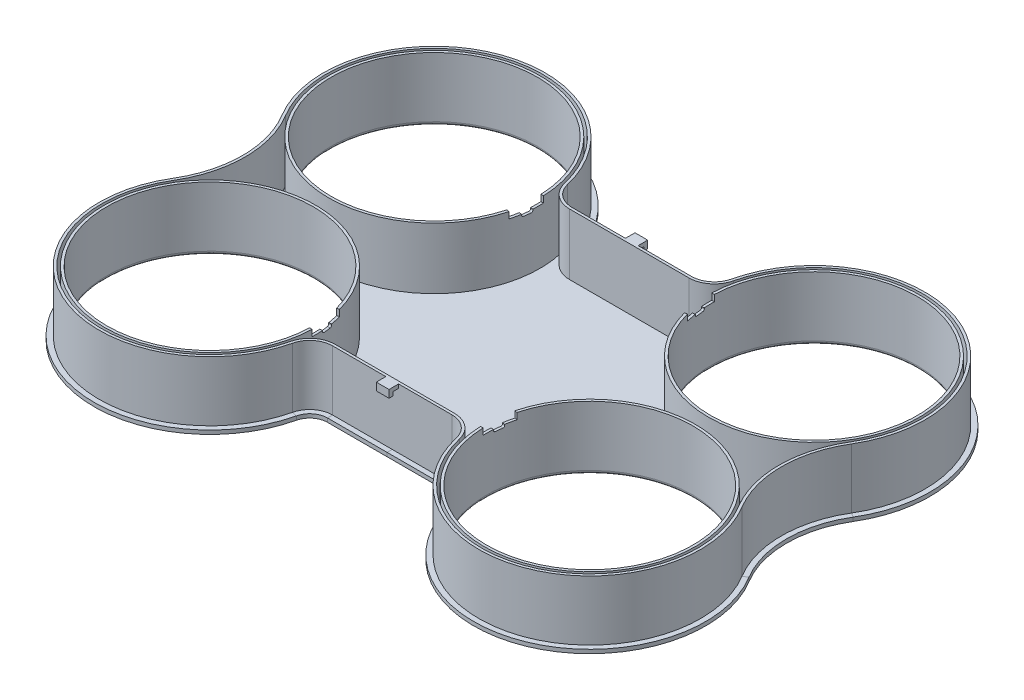
from build123d import *

# Parameters (mm, degrees)
BASE_DEPTH                                  = 25
SKETCH3_R                                   = 40.5
PROPHOLES_DEPTH                             = 25
SHELL2_T                                    = -1
SKETCH4_W                                   = 2
SKETCH4_H                                   = 1.5
HOOKS_DEPTH                                 = 2.5
FILLET1_R                                   = 1.5
ARMHOLES_DEPTH                              = 2.5
ARMDETAILCUT_DEPTH                          = 2.5
ARMDETAILS_AT_THE_SECOND_PLANE_COPY_1_DEPTH = 2.5


with BuildPart() as part:
    # Sketch1 → Base (new body)
    with BuildSketch(Plane(origin=(0, 0, 0), x_dir=(1, 0, 0), z_dir=(0, 1, 0))):
        with BuildLine():
            Line((-23.389824888, 47), (23.389824888, 47))
            ThreePointArc((23.389824888, 47), (28.979355918, 48.946125685), (32.151569193, 53.942857143))
            ThreePointArc((32.151569193, 53.942857143), (90.931692418, 84.277158344), (111.718349922, 21.482352941))
            ThreePointArc((111.718349922, 21.482352941), (105.725511342, 0), (111.718349922, -21.482352941))
            ThreePointArc((111.718349922, -21.482352941), (90.931692418, -84.277158344), (32.151569193, -53.942857143))
            ThreePointArc((32.151569193, -53.942857143), (28.979355918, -48.946125685), (23.389824888, -47))
            Line((23.389824888, -47), (-23.389824888, -47))
            ThreePointArc((-23.389824888, -47), (-28.979355918, -48.946125685), (-32.151569193, -53.942857143))
            ThreePointArc((-32.151569193, -53.942857143), (-90.931692418, -84.277158344), (-111.718349922, -21.482352941))
            ThreePointArc((-111.718349922, -21.482352941), (-105.725511342, 0), (-111.718349922, 21.482352941))
            ThreePointArc((-111.718349922, 21.482352941), (-90.931692418, 84.277158344), (-32.151569193, 53.942857143))
            ThreePointArc((-32.151569193, 53.942857143), (-28.979355918, 48.946125685), (-23.389824888, 47))
        make_face()
    extrude(amount=BASE_DEPTH)

    # Sketch3 → PropHoles (cut)
    with BuildSketch(Plane(origin=(0, 25, 0), x_dir=(1, 0, 0), z_dir=(0, 1, 0))):
        with Locations((74.5, 44)):
            Circle(SKETCH3_R)
        with Locations((74.5, -44)):
            Circle(SKETCH3_R)
        with Locations((-74.5, -44)):
            Circle(SKETCH3_R)
        with Locations((-74.5, 44)):
            Circle(SKETCH3_R)
    extrude(amount=-PROPHOLES_DEPTH, mode=Mode.SUBTRACT)

    # Shell2
    shell2_openings = [part.faces().sort_by_distance(p)[0] for p in [
        (0, 25, 0),
    ]]
    offset(amount=SHELL2_T, openings=shell2_openings, kind=Kind.INTERSECTION)

    # Lip: sweep along a path in Sketch1<2>
    with BuildLine(Plane(origin=(0, 0, 0), x_dir=(1, 0, 0), z_dir=(0, 1, 0))) as lip_path:
        Line((-23.389824888, 47), (23.389824888, 47))
        ThreePointArc((23.389824888, 47), (28.979355918, 48.946125685), (32.151569193, 53.942857143))
        ThreePointArc((32.151569193, 53.942857143), (90.931692418, 84.277158344), (111.718349922, 21.482352941))
        ThreePointArc((111.718349922, 21.482352941), (105.725511342, 0), (111.718349922, -21.482352941))
        ThreePointArc((111.718349922, -21.482352941), (90.931692418, -84.277158344), (32.151569193, -53.942857143))
        ThreePointArc((32.151569193, -53.942857143), (28.979355918, -48.946125685), (23.389824888, -47))
        Line((23.389824888, -47), (-23.389824888, -47))
        ThreePointArc((-23.389824888, -47), (-28.979355918, -48.946125685), (-32.151569193, -53.942857143))
        ThreePointArc((-32.151569193, -53.942857143), (-90.931692418, -84.277158344), (-111.718349922, -21.482352941))
        ThreePointArc((-111.718349922, -21.482352941), (-105.725511342, 0), (-111.718349922, 21.482352941))
        ThreePointArc((-111.718349922, 21.482352941), (-90.931692418, 84.277158344), (-32.151569193, 53.942857143))
        ThreePointArc((-32.151569193, 53.942857143), (-28.979355918, 48.946125685), (-23.389824888, 47))
    # Sketch4 → Lip (sweep)
    with BuildSketch(Plane(origin=(0, 0, 0), x_dir=(0, 0, -1), z_dir=(1, 0, 0))):
        with Locations((-48, 0.75)):
            Rectangle(SKETCH4_W, SKETCH4_H)
    sweep(path=lip_path.line)

    # Sketch5 → Hooks (add, symmetric)
    with BuildSketch(Plane(origin=(0, 0, 0), x_dir=(0, 0, -1), z_dir=(1, 0, 0))):
        Polygon((-47, 25), (-50.75, 25), (-50.75, 22), (-49.25, 22), (-49.25, 23.5), (-47, 23.5), align=None)
        Polygon((49.25, 23.5), (47, 23.5), (47, 25), (50.75, 25), (50.75, 22), (49.25, 22), align=None)
    extrude(amount=HOOKS_DEPTH, both=True)

    # Fillet1
    fillet1_edges = [part.edges().sort_by_distance(p)[0] for p in [
        (-115, 0, -44),
        (34, 0, -44),
        (34, 0, 44),
        (-115, 0, 44),
    ]]
    fillet(fillet1_edges, radius=FILLET1_R)

    # Sketch6 → ArmHoles (cut)
    with BuildSketch(Plane(origin=(0, 25, 0), x_dir=(1, 0, 0), z_dir=(0, 1, 0))):
        with BuildLine():
            Line((74.5, -44), (34.426621288, -33.212307077))
            ThreePointArc((34.426621288, -33.212307077), (33.272270217, -39.25402308), (33.02362118, -45.4))
            Line((33.02362118, -45.4), (74.5, -44))
        make_face()
        with BuildLine():
            Line((74.5, 44), (33.02362118, 45.4))
            ThreePointArc((33.02362118, 45.4), (33.272270217, 39.25402308), (34.426621288, 33.212307077))
            Line((34.426621288, 33.212307077), (74.5, 44))
        make_face()
        with BuildLine():
            Line((-74.5, 44), (-34.426621288, 33.212307077))
            ThreePointArc((-34.426621288, 33.212307077), (-33.272270217, 39.25402308), (-33.02362118, 45.4))
            Line((-33.02362118, 45.4), (-74.5, 44))
        make_face()
        with BuildLine():
            Line((-74.5, -44), (-33.02362118, -45.4))
            ThreePointArc((-33.02362118, -45.4), (-33.272270217, -39.25402308), (-34.426621288, -33.212307077))
            Line((-34.426621288, -33.212307077), (-74.5, -44))
        make_face()
    extrude(amount=-ARMHOLES_DEPTH, mode=Mode.SUBTRACT)

    # Sketch7 → ArmDetailCut (cut)
    with BuildSketch(Plane(origin=(38.732173012, 0, 4.45869807), x_dir=(-0.11436088964892253, 0, 0.9934392718826386), z_dir=(-0.9934392718826385, 0, -0.11436088964892252))):
        with BuildLine():
            Line((36.605160533, 21.5), (33.805160533, 21.5))
            ThreePointArc((33.805160533, 21.5), (33.380896465, 21.675735931), (33.205160533, 22.1))
            Line((33.205160533, 22.1), (33.205160533, 22.5))
            Line((33.205160533, 22.5), (37.205160533, 22.5))
            Line((37.205160533, 22.5), (37.205160533, 22.1))
            ThreePointArc((37.205160533, 22.1), (37.029424602, 21.675735931), (36.605160533, 21.5))
        make_face()
    armdetailcut = extrude(amount=ARMDETAILCUT_DEPTH, mode=Mode.SUBTRACT)

    # ArmDetails: ArmDetailCut across plane
    add(armdetailcut.mirror(Plane.XY), mode=Mode.SUBTRACT)

    # ArmDetails at the second plane: ArmDetailCut across plane
    add(armdetailcut.mirror(Plane(origin=(0, 0, 0), x_dir=(0, 0, 1), z_dir=(1, 0, 0))), mode=Mode.SUBTRACT)

    # ArmDetails at the second plane copy 1 sk → ArmDetails at the second plane copy 1 (cut)
    with BuildSketch(Plane(origin=(-38.732173012, 0, -4.45869807), x_dir=(0.11436088964892253, 0, -0.9934392718826386), z_dir=(0.9934392718826385, 0, 0.11436088964892252))):
        with BuildLine():
            Line((36.605160533, 21.5), (33.805160533, 21.5))
            ThreePointArc((33.805160533, 21.5), (33.380896465, 21.675735931), (33.205160533, 22.1))
            Line((33.205160533, 22.1), (33.205160533, 22.5))
            Line((33.205160533, 22.5), (37.205160533, 22.5))
            Line((37.205160533, 22.5), (37.205160533, 22.1))
            ThreePointArc((37.205160533, 22.1), (37.029424602, 21.675735931), (36.605160533, 21.5))
        make_face()
    extrude(amount=ARMDETAILS_AT_THE_SECOND_PLANE_COPY_1_DEPTH, mode=Mode.SUBTRACT)


solid = part.part
